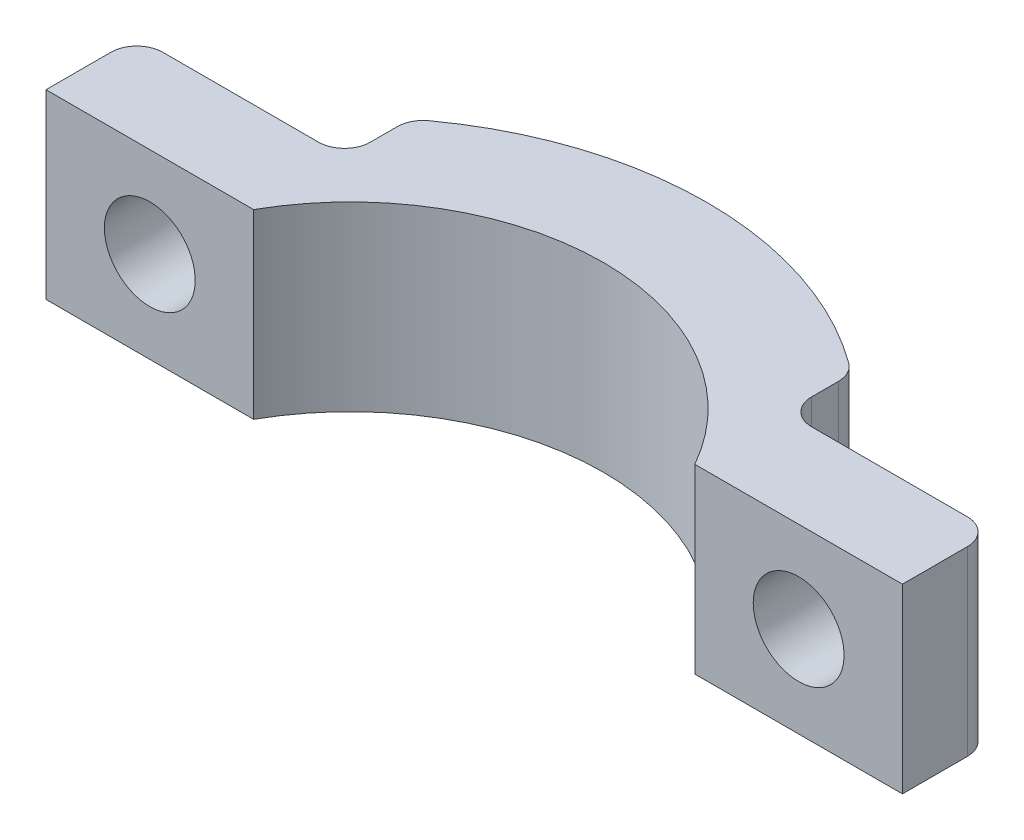
from build123d import *

# Parameters (mm, degrees)
BOSS_EXTRUDE1_DEPTH = 7
SKETCH4_W           = 8
SKETCH4_H           = 7
CUT_EXTRUDE5_DEPTH  = 5.473756706
CUT_EXTRUDE6_REACH  = 28.532
SKETCH7_R           = 1.75
FILLET3_R           = 1


with BuildPart() as part:
    # Sketch1 → Boss-Extrude1 (new body)
    with BuildSketch(Plane(origin=(0, 0, 0), x_dir=(1, 0, 0), z_dir=(0, 1, 0))):
        with BuildLine():
            Line((0, 0), (-8, 0))
            Line((-8, 0), (-8, 3.5))
            Line((-8, 3.5), (-2.480268528, 3.5))
            ThreePointArc((-2.480268528, 3.5), (8.5, 8.973756706), (19.480268528, 3.5))
            Line((19.480268528, 3.5), (25, 3.5))
            Line((25, 3.5), (25, 0))
            Line((25, 0), (17, 0))
            ThreePointArc((17, 0), (8.5, 4.973756706), (0, 0))
        make_face()
    extrude(amount=BOSS_EXTRUDE1_DEPTH)

    # Sketch4 → Cut-Extrude5 (cut)
    with BuildSketch(Plane(origin=(0, 0, -8.973756706), x_dir=(-1, 0, 0), z_dir=(0, 0, -1))):
        with Locations((-21, 3.5)):
            Rectangle(SKETCH4_W, SKETCH4_H)
        with Locations((4, 3.5)):
            Rectangle(SKETCH4_W, SKETCH4_H)
    extrude(amount=-CUT_EXTRUDE5_DEPTH, mode=Mode.SUBTRACT)

    # Sketch7 → Cut-Extrude6 (cut, up to next)
    with BuildSketch(Plane(origin=(0, 0, -3.5), x_dir=(-1, 0, 0), z_dir=(0, 0, -1)), mode=Mode.PRIVATE) as cut_extrude6_sk1:
        with Locations((-20.999991214, 3.5)):
            Circle(SKETCH7_R)
    cut_extrude6_tool1 = extrude(cut_extrude6_sk1.sketch, amount=-CUT_EXTRUDE6_REACH, mode=Mode.PRIVATE) & part.part
    # Sketch7 → Cut-Extrude6 (cut, up to next)
    with BuildSketch(Plane(origin=(0, 0, -3.5), x_dir=(-1, 0, 0), z_dir=(0, 0, -1)), mode=Mode.PRIVATE) as cut_extrude6_sk2:
        with Locations((4.000006362, 3.511008166)):
            Circle(SKETCH7_R)
    cut_extrude6_tool2 = extrude(cut_extrude6_sk2.sketch, amount=-CUT_EXTRUDE6_REACH, mode=Mode.PRIVATE) & part.part
    add(cut_extrude6_tool1.solids().sort_by_distance((20.999991, 3.5, -3.5))[0], mode=Mode.SUBTRACT)
    add(cut_extrude6_tool2.solids().sort_by_distance((-4.000006, 3.511008, -3.5))[0], mode=Mode.SUBTRACT)

    # Fillet3
    fillet3_edges = [part.edges().sort_by_distance(p)[0] for p in [
        (-8, 3.5, -3.5),
        (25, 3.5, -3.5),
        (17, 3.5, -6.031739867),
        (17, 3.5, -3.5),
        (0, 3.5, -6.031739867),
        (0, 3.5, -3.5),
    ]]
    fillet(fillet3_edges, radius=FILLET3_R)


solid = part.part
